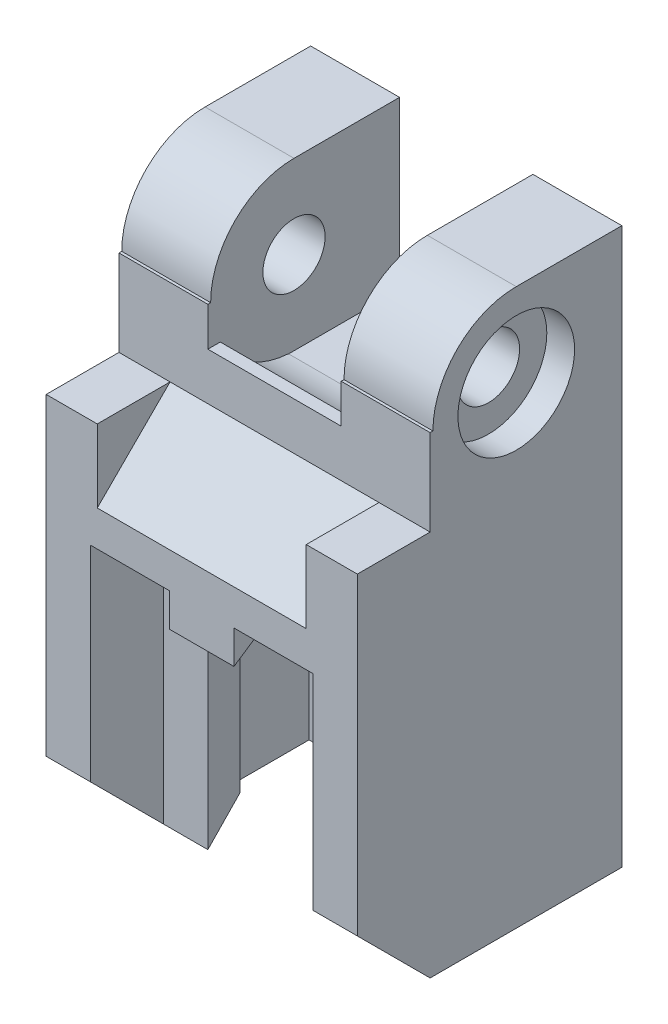
from build123d import *

# Parameters (mm, degrees)
SKETCH1_W                    = 26
SKETCH1_H                    = 28
BOSS_EXTRUDE1_DEPTH          = 50
CUT_EXTRUDE6_DEPTH           = 25
CUT_EXTRUDE3_DEPTH           = 39
SKETCH14_R                   = 7.5
BOSS_EXTRUDE7_DEPTH          = 7
SKETCH15_R                   = 2.8
CUT_EXTRUDE4_DEPTH           = 28
SKETCH16_R                   = 5.25
CUT_EXTRUDE5_DEPTH           = 1.5
CUT_EXTRUDE7_DEPTH           = 54.525694764
SKETCH19_R                   = 2.15
CUT_EXTRUDE9_DEPTH           = 50
ESQUISSE1_W                  = 12
ESQUISSE1_H                  = 9.5
ENL_V_MAT_EXTRU_1_DEPTH      = 7.5
ESQUISSE3_W                  = 12
ESQUISSE3_H                  = 7.5
ENL_V_MAT_EXTRU_3_DEPTH      = 10
BOSS_EXTRU_1_DEPTH           = 26
ENL_V_MAT_EXTRU_5_DEPTH      = 3.5
ESQUISSE9_W                  = 5.8
ESQUISSE9_H                  = 3
BOSS_EXTRU_3_DEPTH           = 1
BOSS_EXTRU_4_DEPTH           = 5.8
BOSS_EXTRU_5_DEPTH           = 0.1
BOSS_EXTRU_6_DEPTH           = 0.1
ESQUISSE13_W                 = 6.55
ESQUISSE13_H                 = 9.75
BOSS_EXTRU_7_DEPTH           = 3.6
ESQUISSE14_W                 = 6.55
ESQUISSE14_H                 = 9.75
BOSS_EXTRU_8_DEPTH           = 3.6
ESQUISSE16_R                 = 5.25
BOSS_EXTRU_9_DEPTH           = 1
BOSS_EXTRU_10_START          = 1
ESQUISSE17_R                 = 5.25
BOSS_EXTRU_10_DEPTH          = 1
ESQUISSE20_W                 = 4
ESQUISSE20_H                 = 25
BOSS_EXTRU_11_DEPTH          = 6.55
ENL_V_MAT_EXTRU_6_DEPTH      = 34
ENL_V_MAT_EXTRU_6_DEPTH_BACK = 10


with BuildPart() as part:
    # Sketch1 → Boss-Extrude1 (new body)
    with BuildSketch(Plane(origin=(0, 0, 0), x_dir=(1, 0, 0), z_dir=(0, 1, 0))):
        Rectangle(SKETCH1_W, SKETCH1_H)
    extrude(amount=BOSS_EXTRUDE1_DEPTH)

    # Sketch3 → Cut-Extrude6 (cut)
    with BuildSketch(Plane(origin=(0, 0, 0), x_dir=(1, 0, 0), z_dir=(0, 1, 0))):
        Polygon((9.998973293, 2.65), (9.998973293, 9.85), (2.900254006, 9.85), (2.881158298, 5.822816277), (-2.918777792, 5.850044076), (-2.9, 9.85), (-10, 9.85), (-10, 2.65), (-9, 2.65), (-6, -3.25), (-10, -3.25), (-10, -4.35), (-10, -15.089504782), (10.190019105, -15.10204882), (10.123266065, -8.899331206), (10.068921607, -3.849623622), (10.062468516, -3.25), (6.072889948, -3.25), (8.998973293, 2.65), align=None)
    extrude(amount=CUT_EXTRUDE6_DEPTH, mode=Mode.SUBTRACT)

    # Sketch7 → Cut-Extrude3 (cut)
    with BuildSketch(Plane(origin=(13, 0, 0), x_dir=(0, 0, -1), z_dir=(1, 0, 0))):
        with BuildLine():
            Line((4.5, 50), (-14, 50))
            Line((-14, 50), (-14, 24))
            Line((-14, 24), (-0.803300859, 37.196699141))
            ThreePointArc((-0.803300859, 37.196699141), (11.429096494, 39.629874257), (4.5, 50))
        make_face()
    extrude(amount=-CUT_EXTRUDE3_DEPTH, mode=Mode.SUBTRACT)

    # Sketch14 → Boss-Extrude7 (add)
    with BuildSketch(Plane(origin=(13, 0, 0), x_dir=(0, 0, -1), z_dir=(1, 0, 0))):
        with Locations((4.5, 42.5)):
            Circle(SKETCH14_R)
    boss_extrude7 = extrude(amount=-BOSS_EXTRUDE7_DEPTH)

    # Symétrie1: Boss-Extrude7 across plane
    add(boss_extrude7.mirror(Plane(origin=(0, 0, 0), x_dir=(0, 0, 1), z_dir=(1, 0, 0))))

    # Sketch15 → Cut-Extrude4 (cut)
    with BuildSketch(Plane(origin=(13, 0, 0), x_dir=(0, 0, -1), z_dir=(1, 0, 0))):
        with Locations((4.5, 42.5)):
            Circle(SKETCH15_R)
    extrude(amount=-CUT_EXTRUDE4_DEPTH, mode=Mode.SUBTRACT)

    # Sketch16 → Cut-Extrude5 (cut)
    with BuildSketch(Plane(origin=(13, 0, 0), x_dir=(0, 0, -1), z_dir=(1, 0, 0))):
        with Locations((4.5, 42.5)):
            Circle(SKETCH16_R)
    cut_extrude5 = extrude(amount=-CUT_EXTRUDE5_DEPTH, mode=Mode.SUBTRACT)

    # Mirror3: Cut-Extrude5 across plane
    add(cut_extrude5.mirror(Plane(origin=(0, 0, 0), x_dir=(0, 0, 1), z_dir=(1, 0, 0))), mode=Mode.SUBTRACT)

    # Sketch17 → Cut-Extrude7 (cut, through all)
    with BuildSketch(Plane.XZ):
        Polygon((-9.3, 3.25), (-13, 3.25), (-13, 14), (13, 14), (13, 3.25), (9.3, 3.25), (9.3, 9.8), (-9.3, 9.8), align=None)
    extrude(amount=-CUT_EXTRUDE7_DEPTH, mode=Mode.SUBTRACT)

    # Sketch19 → Cut-Extrude9 (cut)
    with BuildSketch(Plane(origin=(0, 0, -14), x_dir=(-1, 0, 0), z_dir=(0, 0, -1))):
        with Locations((0, 15)):
            Circle(SKETCH19_R)
    extrude(amount=-CUT_EXTRUDE9_DEPTH, mode=Mode.SUBTRACT)

    # Esquisse1 → Enlèv. mat.-Extru.1 (cut)
    with BuildSketch(Plane(origin=(0, 50, 0), x_dir=(1, 0, 0), z_dir=(0, 1, 0))):
        with Locations((0, 9.25)):
            Rectangle(ESQUISSE1_W, ESQUISSE1_H)
    extrude(amount=-ENL_V_MAT_EXTRU_1_DEPTH, mode=Mode.SUBTRACT)

    # Esquisse3 → Enlèv. mat.-Extru.3 (cut)
    with BuildSketch(Plane(origin=(0, 0, -14), x_dir=(-1, 0, 0), z_dir=(0, 0, -1))):
        with Locations((0, 38.75)):
            Rectangle(ESQUISSE3_W, ESQUISSE3_H)
    extrude(amount=-ENL_V_MAT_EXTRU_3_DEPTH, mode=Mode.SUBTRACT)

    # Esquisse6 → Boss.-Extru.1 (add)
    with BuildSketch(Plane(origin=(13, 0, 0), x_dir=(0, 0, -1), z_dir=(1, 0, 0))):
        with BuildLine():
            Line((-3.25, 34.75), (-3.25, 42.5))
            Line((-3.25, 42.5), (-3, 42.5))
            ThreePointArc((-3, 42.5), (-2.429096494, 39.629874257), (-0.803300859, 37.196699141))
            Line((-0.803300859, 37.196699141), (-3.25, 34.75))
        make_face()
    extrude(amount=-BOSS_EXTRU_1_DEPTH)

    # Esquisse7 → Enlèv. mat.-Extru.5 (cut)
    with BuildSketch(Plane(origin=(0, 42.5, 0), x_dir=(1, 0, 0), z_dir=(0, 1, 0))):
        Polygon((6, 3.615864876), (6, -7.096354864), (-6, -3.780069791), (-6, 8.456914553), align=None)
    extrude(amount=-ENL_V_MAT_EXTRU_5_DEPTH, mode=Mode.SUBTRACT)

    # Esquisse9 → Boss.-Extru.3 (add)
    with BuildSketch(Plane(origin=(0, 25, 0), x_dir=(-1, 0, 0), z_dir=(0, -1, 0))):
        with Locations((0, -8.3)):
            Rectangle(ESQUISSE9_W, ESQUISSE9_H)
    extrude(amount=BOSS_EXTRU_3_DEPTH)

    # Esquisse10 → Boss.-Extru.4 (add)
    with BuildSketch(Plane.ZY.offset(2.9)):
        Polygon((9.8, 24), (9.8, 22), (6.8, 24), align=None)
    extrude(amount=-BOSS_EXTRU_4_DEPTH)

    # Esquisse11 → Boss.-Extru.5 (add)
    with BuildSketch(Plane.ZY.offset(9.3)):
        Polygon((3.25, 34.75), (9.8, 28.2), (9.8, 25), (3.25, 25), align=None)
    extrude(amount=BOSS_EXTRU_5_DEPTH)

    # Esquisse12 → Boss.-Extru.6 (add)
    with BuildSketch(Plane(origin=(9.3, 0, 0), x_dir=(0, 0, -1), z_dir=(1, 0, 0))):
        Polygon((-9.8, 25), (-9.8, 28.2), (-3.25, 34.75), (-3.25, 25), align=None)
    extrude(amount=BOSS_EXTRU_6_DEPTH)

    # Esquisse13 → Boss.-Extru.7 (add)
    with BuildSketch(Plane(origin=(9.4, 0, 0), x_dir=(0, 0, -1), z_dir=(1, 0, 0))):
        with Locations((-6.525, 29.875)):
            Rectangle(ESQUISSE13_W, ESQUISSE13_H)
    extrude(amount=BOSS_EXTRU_7_DEPTH)

    # Esquisse14 → Boss.-Extru.8 (add)
    with BuildSketch(Plane.ZY.offset(9.4)):
        with Locations((6.525, 29.875)):
            Rectangle(ESQUISSE14_W, ESQUISSE14_H)
    extrude(amount=BOSS_EXTRU_8_DEPTH)

    # Esquisse16 → Boss.-Extru.9 (add)
    with BuildSketch(Plane.ZY.offset(13)):
        with BuildLine():
            Line((3.25, 0), (-14, 0))
            Line((-14, 0), (-14, 50))
            Line((-14, 50), (-4.5, 50))
            ThreePointArc((-4.5, 50), (0.803300859, 47.803300859), (3, 42.5))
            Line((3, 42.5), (3.25, 42.5))
            Line((3.25, 42.5), (3.25, 34.75))
            Line((3.25, 34.75), (9.8, 34.75))
            Line((9.8, 34.75), (9.8, 25))
            Line((9.8, 25), (3.25, 25))
            Line((3.25, 25), (3.25, 0))
        make_face()
        with Locations(Location((-4.5, 42.5, 0), (0, 0, 180))):
            Circle(ESQUISSE16_R, mode=Mode.SUBTRACT)
    extrude(amount=BOSS_EXTRU_9_DEPTH)

    # Esquisse17 → Boss.-Extru.10 (add)
    with BuildSketch(Plane(origin=(13, 0, 0), x_dir=(0, 0, -1), z_dir=(1, 0, 0)).offset(BOSS_EXTRU_10_START)):
        with BuildLine():
            Line((-3, 42.5), (-3.25, 42.5))
            Line((-3.25, 42.5), (-3.25, 34.75))
            Line((-3.25, 34.75), (-9.8, 34.75))
            Line((-9.8, 34.75), (-9.8, 25))
            Line((-9.8, 25), (-3.25, 25))
            Line((-3.25, 25), (-3.25, 0))
            Line((-3.25, 0), (14, 0))
            Line((14, 0), (14, 50))
            Line((14, 50), (4.5, 50))
            ThreePointArc((4.5, 50), (-0.803300859, 47.803300859), (-3, 42.5))
        make_face()
        with Locations((4.5, 42.5)):
            Circle(ESQUISSE17_R, mode=Mode.SUBTRACT)
    extrude(amount=-BOSS_EXTRU_10_DEPTH)

    # Esquisse20 → Boss.-Extru.11 (add)
    with BuildSketch(Plane.XY.offset(3.25)):
        with Locations((-12, 12.5)):
            Rectangle(ESQUISSE20_W, ESQUISSE20_H)
        with Locations((12, 12.5)):
            Rectangle(ESQUISSE20_W, ESQUISSE20_H)
    extrude(amount=BOSS_EXTRU_11_DEPTH)

    # Esquisse22 → Enlèv. mat.-Extru.6 (cut, two sides: drawn at the far end of the back side and taken through both)
    with BuildSketch(Plane.ZY.offset(-10).offset(-ENL_V_MAT_EXTRU_6_DEPTH_BACK)):
        Polygon((3.25, 0), (9.8, 6.55), (13.122553289, -3.826398857), (3.25, -3.616824535), align=None)
    extrude(amount=ENL_V_MAT_EXTRU_6_DEPTH + ENL_V_MAT_EXTRU_6_DEPTH_BACK, mode=Mode.SUBTRACT)


solid = part.part
